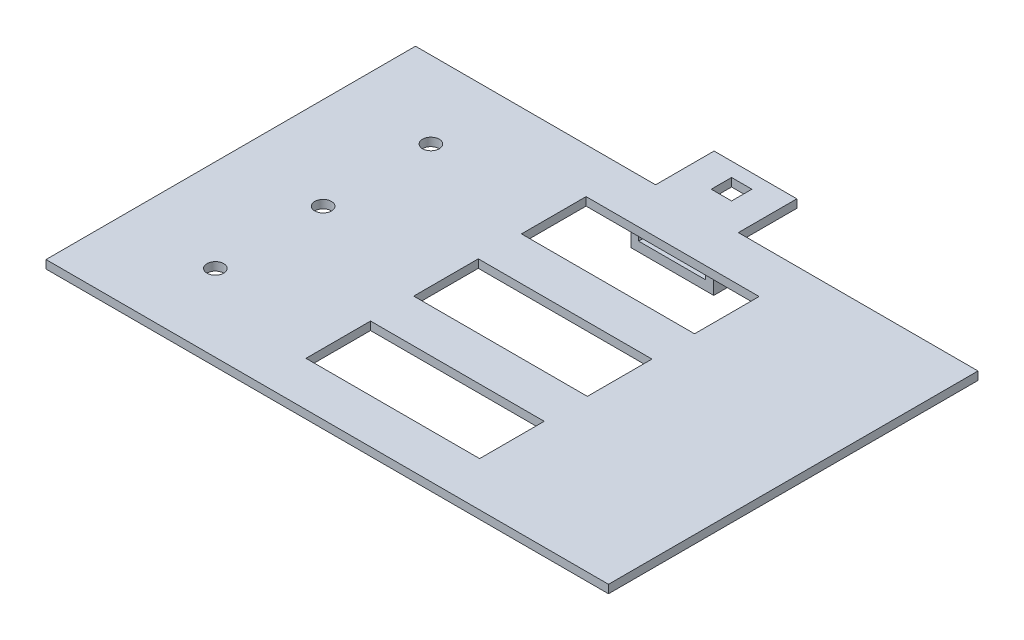
from build123d import *

# Parameters (mm, degrees)
SKETCH1_W           = 232.0036
SKETCH1_H           = 152.4
BOSS_EXTRUDE1_DEPTH = 3.4036
SKETCH2_R           = 3.4417
SKETCH2_W           = 71.374
SKETCH2_H           = 26.6446
SKETCH2_W_2         = 71.628
CUT_EXTRUDE1_DEPTH  = 278.602260268
SKETCH3_W           = 34.1376
SKETCH3_H           = 13.97
BOSS_EXTRUDE2_DEPTH = 13.97
SKETCH4_W           = 27.5844
SKETCH4_H           = 6.6548
CUT_EXTRUDE2_DEPTH  = 16.51
SKETCH5_W           = 34.1376
SKETCH5_H           = 3.4036
BOSS_EXTRUDE3_DEPTH = 24.13
SKETCH6_W           = 8.382
SKETCH6_H           = 8.382
CUT_EXTRUDE3_DEPTH  = 293.04512201


with BuildPart() as part:
    # Sketch1 → Boss-Extrude1 (new body)
    with BuildSketch(Plane(origin=(0, 0, 0), x_dir=(1, 0, 0), z_dir=(0, 1, 0))):
        with Locations((116.0018, 76.2)):
            Rectangle(SKETCH1_W, SKETCH1_H)
    extrude(amount=BOSS_EXTRUDE1_DEPTH)

    # Sketch2 → Cut-Extrude1 (cut, through all)
    with BuildSketch(Plane(origin=(0, 3.4036, 0), x_dir=(1, 0, 0), z_dir=(0, 1, 0))):
        with Locations(Location((38.1, 120.65, 0), (0, 0, 270))):
            Circle(SKETCH2_R)
        with Locations(Location((38.1, 76.2, 0), (0, 0, 270))):
            Circle(SKETCH2_R)
        with Locations(Location((38.1, 31.75, 0), (0, 0, 270))):
            Circle(SKETCH2_R)
        with Locations((124.587, 120.5357)):
            Rectangle(SKETCH2_W, SKETCH2_H)
        with Locations((124.714, 76.0857)):
            Rectangle(SKETCH2_W_2, SKETCH2_H)
        with Locations((124.714, 31.6357)):
            Rectangle(SKETCH2_W_2, SKETCH2_H)
    extrude(amount=-CUT_EXTRUDE1_DEPTH, mode=Mode.SUBTRACT)

    # Sketch3 → Boss-Extrude2 (add)
    with BuildSketch(Plane.XZ):
        with Locations((116.0907, -149.225)):
            Rectangle(SKETCH3_W, SKETCH3_H)
    extrude(amount=BOSS_EXTRUDE2_DEPTH)

    # Sketch4 → Cut-Extrude2 (cut)
    with BuildSketch(Plane(origin=(0, 0, -156.21), x_dir=(-1, 0, 0), z_dir=(0, 0, -1))):
        with Locations((-115.9637, -6.731)):
            Rectangle(SKETCH4_W, SKETCH4_H)
    extrude(amount=-CUT_EXTRUDE2_DEPTH, mode=Mode.SUBTRACT)

    # Sketch5 → Boss-Extrude3 (add)
    with BuildSketch(Plane(origin=(0, 0, -152.4), x_dir=(-1, 0, 0), z_dir=(0, 0, -1))):
        with Locations((-116.0907, 1.7018)):
            Rectangle(SKETCH5_W, SKETCH5_H)
    extrude(amount=BOSS_EXTRUDE3_DEPTH)

    # Sketch6 → Cut-Extrude3 (cut, through all)
    with BuildSketch(Plane(origin=(0, 3.4036, 0), x_dir=(1, 0, 0), z_dir=(0, 1, 0))):
        with Locations((116.2685, 166.497)):
            Rectangle(SKETCH6_W, SKETCH6_H)
    extrude(amount=-CUT_EXTRUDE3_DEPTH, mode=Mode.SUBTRACT)


solid = part.part
